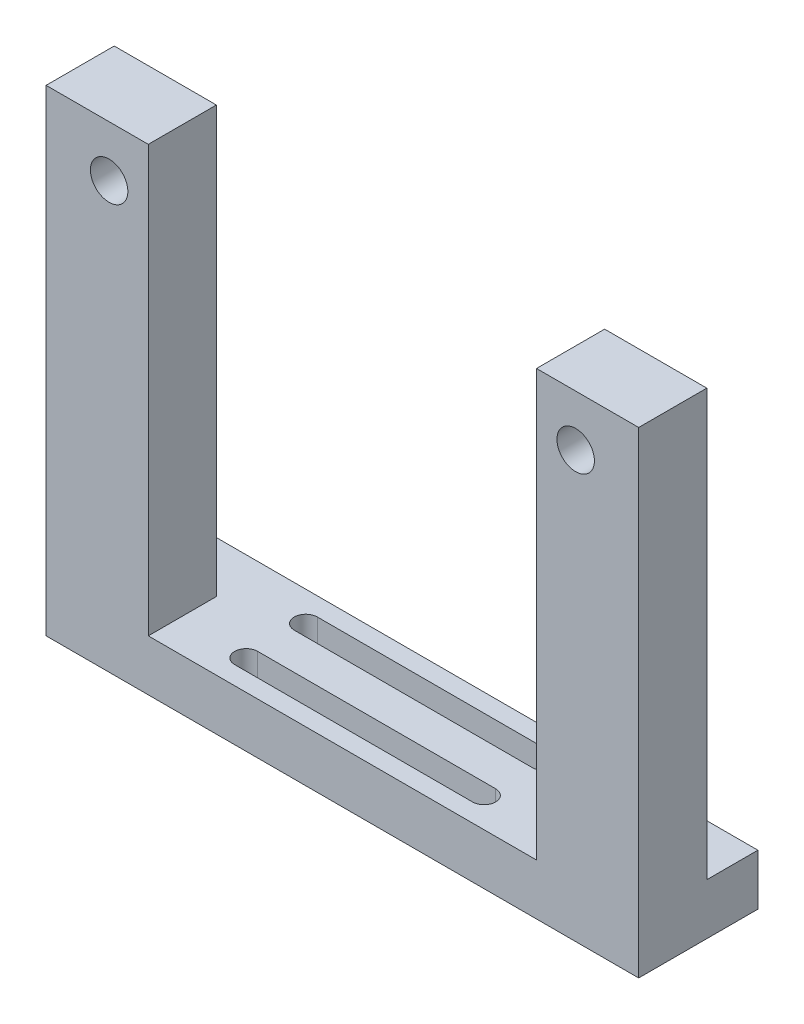
from build123d import *

# Parameters (mm, degrees)
SKETCH_1_W          = 6
SKETCH_1_H          = 25
SKETCH_1_H_2        = 3
SKETCH_1_W_2        = 22.8
EXTRUDE_1_DEPTH     = 4
SKETCH_3_R          = 1.1
CUT_EXTRUDE_2_DEPTH = 23.688322988
SKETCH_4_W          = 34.8
SKETCH_4_H          = 3
EXTRUDE_2_DEPTH     = 3
CUT_EXTRUDE_3_DEPTH = 31.720677076


with BuildPart() as part:
    # 草图1 → 凸台-拉伸1 (new body)
    with BuildSketch(Plane.XY):
        with Locations((-14.4, 1.5)):
            Rectangle(SKETCH_1_W, SKETCH_1_H)
        with Locations((-14.4, -12.5)):
            Rectangle(SKETCH_1_W, SKETCH_1_H_2)
        with Locations((0, -12.5)):
            Rectangle(SKETCH_1_W_2, SKETCH_1_H_2)
        with Locations((14.4, -12.5)):
            Rectangle(SKETCH_1_W, SKETCH_1_H_2)
        with Locations((14.4, 1.5)):
            Rectangle(SKETCH_1_W, SKETCH_1_H)
    extrude(amount=EXTRUDE_1_DEPTH)

    # 草图3 → 切除-拉伸2 (cut, through all)
    with BuildSketch(Plane(origin=(0, 0, 0), x_dir=(-1, 0, 0), z_dir=(0, 0, -1))):
        with Locations((-13.7, 11)):
            Circle(SKETCH_3_R)
        with Locations((13.7, 11)):
            Circle(SKETCH_3_R)
    extrude(amount=-CUT_EXTRUDE_2_DEPTH, mode=Mode.SUBTRACT)

    # 草图4 → 凸台-拉伸2 (add)
    with BuildSketch(Plane.XZ.offset(14)):
        with Locations((0, -1.5)):
            Rectangle(SKETCH_4_W, SKETCH_4_H)
    extrude(amount=-EXTRUDE_2_DEPTH)

    # 草图5 → 切除-拉伸3 (cut, through all)
    with BuildSketch(Plane(origin=(0, -11, 0), x_dir=(1, 0, 0), z_dir=(0, 1, 0))):
        with BuildLine():
            Line((6.571482936, 0.575), (-7.4, 0.575))
            ThreePointArc((-7.4, 0.575), (-8.075, 1.25), (-7.4, 1.925))
            Line((-7.4, 1.925), (6.571482936, 1.925))
            ThreePointArc((6.571482936, 1.925), (7.246482936, 1.25), (6.571482936, 0.575))
        make_face()
        with BuildLine():
            Line((-7.4, -1.575), (6.571482936, -1.575))
            ThreePointArc((6.571482936, -1.575), (7.246482936, -2.25), (6.571482936, -2.925))
            Line((6.571482936, -2.925), (-7.4, -2.925))
            ThreePointArc((-7.4, -2.925), (-8.075, -2.25), (-7.4, -1.575))
        make_face()
    extrude(amount=-CUT_EXTRUDE_3_DEPTH, mode=Mode.SUBTRACT)


solid = part.part
